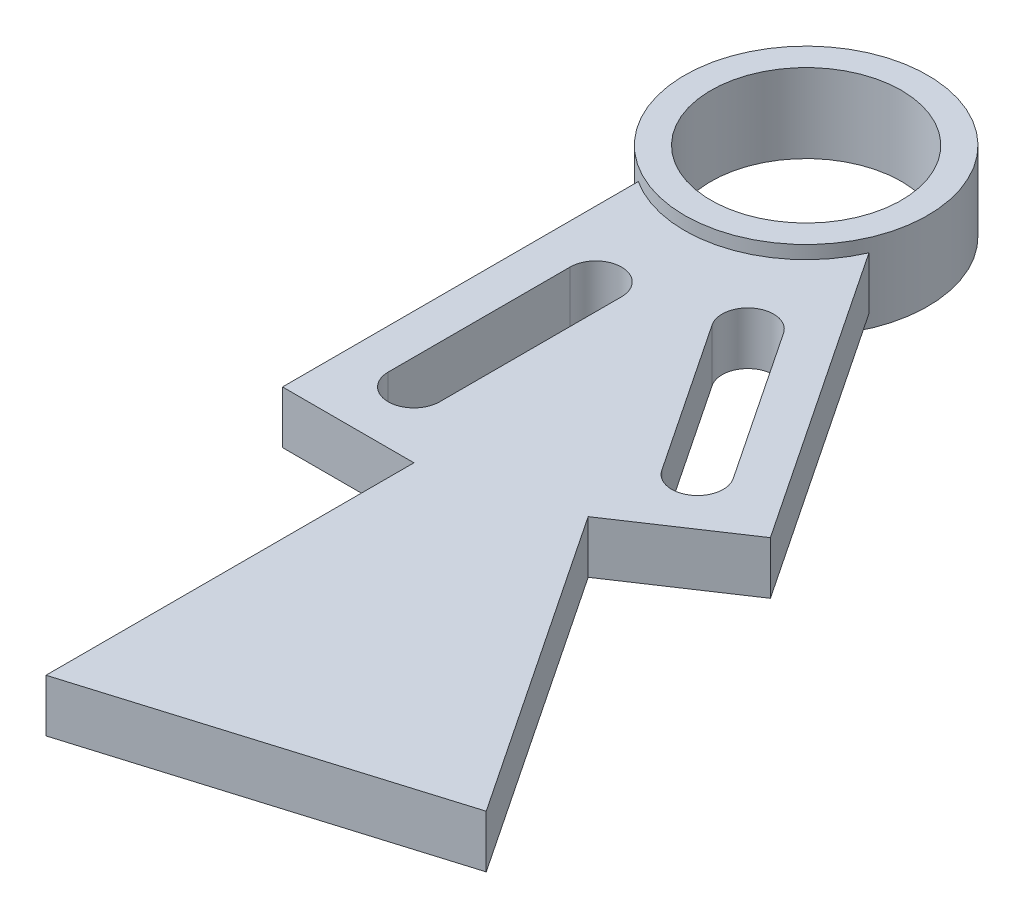
from build123d import *

# Parameters (mm, degrees)
SKETCH1_R             = 11.5062
BEARING_EXTRUDE_DEPTH = 4.7625
BOSS_EXTRUDE2_DEPTH   = 3.175


with BuildPart() as part:
    # Sketch1 → Bearing extrude (new, symmetric)
    with BuildSketch(Plane(origin=(0, 0, 0), x_dir=(1, 0, 0), z_dir=(0, 1, 0))):
        with BuildLine():
            ThreePointArc((14.6812, 0), (-7.035822924, 12.885450292), (-7.9375, -12.350454534))
            ThreePointArc((-7.9375, -12.350454534), (4.255868346, -14.050808449), (13.456443505, -5.870414094))
            ThreePointArc((13.456443505, -5.870414094), (14.371749577, -2.998407498), (14.6812, 0))
        make_face()
        Circle(SKETCH1_R, mode=Mode.SUBTRACT)
    extrude(amount=BEARING_EXTRUDE_DEPTH, both=True)

    # Sketch1<5> → Boss-Extrude2 (add, symmetric)
    with BuildSketch(Plane(origin=(0, 0, 0), x_dir=(1, 0, 0), z_dir=(0, 1, 0))):
        with BuildLine():
            Line((-7.9375, -12.350454534), (-7.9375, -55.3212))
            Line((-7.9375, -55.3212), (7.9375, -55.3212))
            Line((7.9375, -55.3212), (7.9375, -99.7712))
            Line((7.9375, -99.7712), (48.757235106, -87.407255308))
            Line((48.757235106, -87.407255308), (24.09297176, -50.427847341))
            Line((24.09297176, -50.427847341), (30.696437468, -46.023514601))
            Line((30.696437468, -46.023514601), (37.299903176, -41.61918186))
            Line((37.299903176, -41.61918186), (13.456443505, -5.870414094))
            ThreePointArc((13.456443505, -5.870414094), (4.255868346, -14.050808449), (-7.9375, -12.350454534))
        make_face()
        with BuildLine():
            ThreePointArc((3.1115, -47.3837), (0, -50.4952), (-3.1115, -47.3837))
            Line((-3.1115, -47.3837), (-3.1115, -25.4127))
            ThreePointArc((-3.1115, -25.4127), (0, -22.3012), (3.1115, -25.4127))
            Line((3.1115, -25.4127), (3.1115, -47.3837))
        make_face(mode=Mode.SUBTRACT)
        with BuildLine():
            ThreePointArc((28.880663285, -37.693550458), (29.343310788, -40.029617452), (28.018603162, -42.00860745))
            ThreePointArc((28.018603162, -42.00860745), (25.682536168, -42.471254953), (23.70354617, -41.146547327))
            Line((23.70354617, -41.146547327), (11.512353144, -22.868154246))
            ThreePointArc((11.512353144, -22.868154246), (12.374413268, -18.553097254), (16.68947026, -19.415157378))
            Line((16.68947026, -19.415157378), (28.880663285, -37.693550458))
        make_face(mode=Mode.SUBTRACT)
    extrude(amount=BOSS_EXTRUDE2_DEPTH, both=True)


solid = part.part
